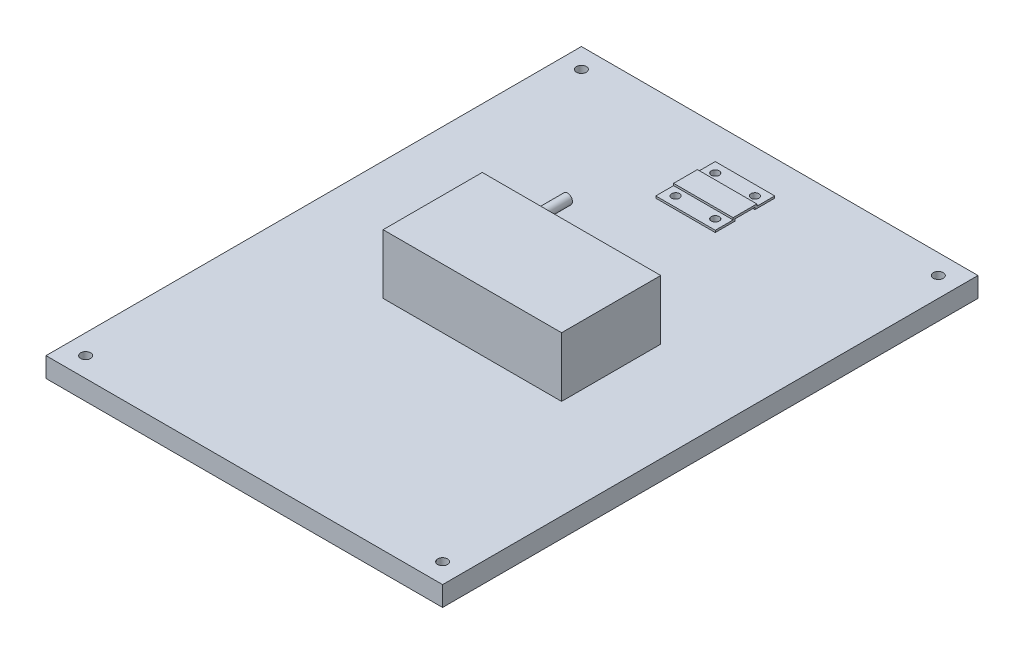
from build123d import *

# Parameters (mm, degrees)
SKETCH_1_W          = 200
SKETCH_1_H          = 270
EXTRUDE_1_DEPTH     = 10
SKETCH_3_R          = 2.5
CUT_EXTRUDE_1_DEPTH = 20
SKETCH_6_W          = 90
SKETCH_6_H          = 50
EXTRUDE_2_DEPTH     = 30
CUT_EXTRUDE_3_REACH = 339.343
SKETCH_9_W          = 17
SKETCH_9_H          = 25
EXTRUDE_4_DEPTH     = 15
SKETCH_11_R         = 2
CUT_EXTRUDE_4_DEPTH = 8
SKETCH_12_R         = 2.5
EXTRUDE_5_DEPTH     = 25


with BuildPart() as part:
    # 草图1 → 凸台-拉伸1 (new body)
    with BuildSketch(Plane(origin=(0, 0, 0), x_dir=(1, 0, 0), z_dir=(0, 1, 0))):
        with Locations((100, 135)):
            Rectangle(SKETCH_1_W, SKETCH_1_H)
    extrude(amount=EXTRUDE_1_DEPTH)

    # 草图3 → 切除-拉伸1 (cut)
    with BuildSketch(Plane(origin=(0, 10, 0), x_dir=(1, 0, 0), z_dir=(0, 1, 0))):
        with Locations(Location((10, 260, 0), (0, 0, 270))):
            Circle(SKETCH_3_R)
        with Locations(Location((10, 10, 0), (0, 0, 270))):
            Circle(SKETCH_3_R)
        with Locations(Location((190, 10, 0), (0, 0, 270))):
            Circle(SKETCH_3_R)
        with Locations(Location((190, 260, 0), (0, 0, 270))):
            Circle(SKETCH_3_R)
    extrude(amount=-CUT_EXTRUDE_1_DEPTH, mode=Mode.SUBTRACT)

    # 草图6 → 凸台-拉伸2 (add)
    with BuildSketch(Plane(origin=(0, 10, 0), x_dir=(1, 0, 0), z_dir=(0, 1, 0))):
        with Locations((105, 135)):
            Rectangle(SKETCH_6_W, SKETCH_6_H)
    extrude(amount=EXTRUDE_2_DEPTH)

    # 草图9 → 切除-拉伸3 (cut, up to next)
    with BuildSketch(Plane(origin=(0, 10, 0), x_dir=(1, 0, 0), z_dir=(0, 1, 0)), mode=Mode.PRIVATE) as cut_extrude_3_sk1:
        with Locations((66.5, 172.5)):
            Rectangle(SKETCH_9_W, SKETCH_9_H)
    cut_extrude_3_tool1 = extrude(cut_extrude_3_sk1.sketch, amount=-CUT_EXTRUDE_3_REACH, mode=Mode.PRIVATE) & part.part
    add(cut_extrude_3_tool1.solids().sort_by_distance((66.5, 10, -172.5))[0], mode=Mode.SUBTRACT)

    # 草图5 → 凸台-拉伸4 (add, symmetric)
    with BuildSketch(Plane(origin=(100, 0, 0), x_dir=(0, 0, -1), z_dir=(1, 0, 0))):
        Polygon((232.5, 10), (232.5, 11), (242.5, 11), (242.5, 10), (252.5, 10), (252.5, 11), (243.5, 11), (243.5, 12), (231.5, 12), (231.5, 11), (222.5, 11), (222.5, 10), align=None)
    extrude(amount=EXTRUDE_4_DEPTH, both=True)

    # 草图11 → 切除-拉伸4 (cut)
    with BuildSketch(Plane(origin=(0, 11, 0), x_dir=(1, 0, 0), z_dir=(0, 1, 0))):
        with Locations(Location((90, 227.5, 0), (0, 0, 270))):
            Circle(SKETCH_11_R)
        with Locations(Location((110, 227.5, 0), (0, 0, 270))):
            Circle(SKETCH_11_R)
        with Locations(Location((90, 247.5, 0), (0, 0, 270))):
            Circle(SKETCH_11_R)
        with Locations(Location((110, 247.5, 0), (0, 0, 270))):
            Circle(SKETCH_11_R)
    extrude(amount=-CUT_EXTRUDE_4_DEPTH, mode=Mode.SUBTRACT)

    # 草图12 → 凸台-拉伸5 (add)
    with BuildSketch(Plane(origin=(0, 0, -160), x_dir=(-1, 0, 0), z_dir=(0, 0, -1))):
        with Locations(Location((-78, 25, 0), (0, 0, 180))):
            Circle(SKETCH_12_R)
    extrude(amount=EXTRUDE_5_DEPTH)


solid = part.part
